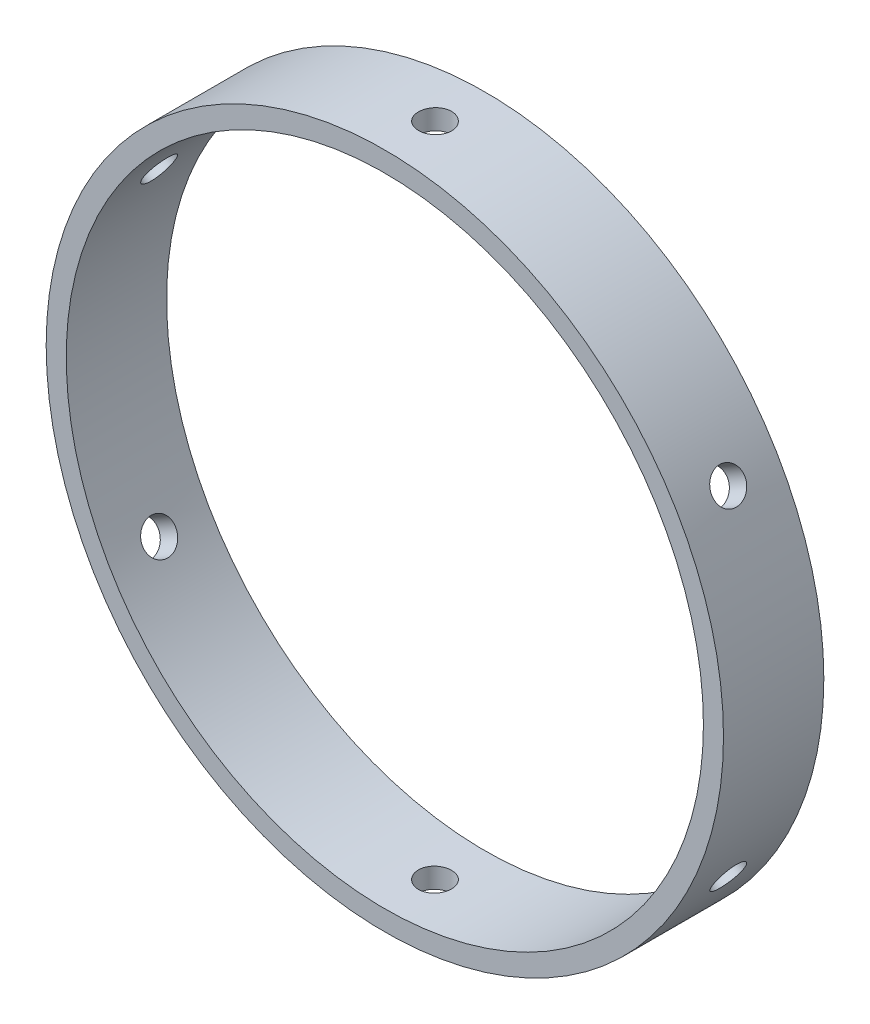
from build123d import *

# Parameters (mm, degrees)
SKETCH1_R           = 33.75
SKETCH1_R_2         = 31.75
BOSS_EXTRUDE1_DEPTH = 5
SKETCH3_W           = 1.65
SKETCH3_H           = 33.75
CIRPATTERN1_COUNT   = 6


with BuildPart() as part:
    # Sketch1 → Boss-Extrude1 (new, symmetric)
    with BuildSketch(Plane.XY):
        Circle(SKETCH1_R)
        Circle(SKETCH1_R_2, mode=Mode.SUBTRACT)
    extrude(amount=BOSS_EXTRUDE1_DEPTH, both=True)

    # Sketch3 → M4x0.7 Tapped Hole1 (revolve, cut)
    with BuildSketch(Plane(origin=(0, 0, 0), x_dir=(0, 0, -1), z_dir=(1, 0, 0))):
        with Locations((0.825, 16.875)):
            Rectangle(SKETCH3_W, SKETCH3_H)
    m4x0_7_tapped_hole1 = revolve(axis=Axis((0, -6.35, 0), (0, 1, 0)), mode=Mode.SUBTRACT)

    # CirPattern1: M4x0.7 Tapped Hole1 ×6 about axis
    cirpattern1_axis = Axis((0, 0, 5), (0, 0, -1))
    for i in range(1, CIRPATTERN1_COUNT):
        add(m4x0_7_tapped_hole1.rotate(cirpattern1_axis, i * 360 / CIRPATTERN1_COUNT), mode=Mode.SUBTRACT)


solid = part.part
